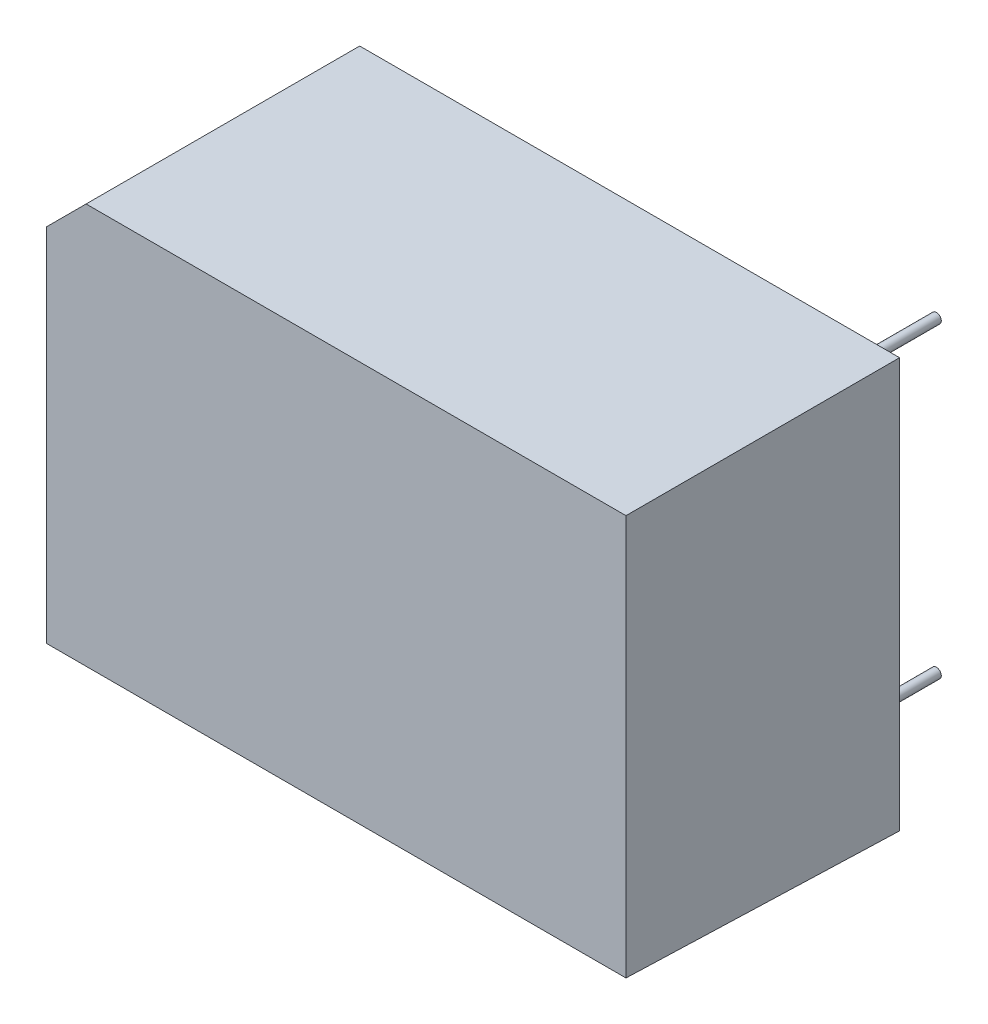
from build123d import *

# Parameters (mm, degrees)
SKETCH2_W           = 45.974
SKETCH2_H           = 32.004
BOSS_EXTRUDE1_DEPTH = 21
BOSS_EXTRUDE1_TAPER = 1
CUT_EXTRUDE1_DEPTH  = 36.006658981
SKETCH3_R           = 0.381
BOSS_EXTRUDE2_DEPTH = 8.128


with BuildPart() as part:
    # Sketch2 → Boss-Extrude1 (new body)
    with BuildSketch(Plane.XY):
        Rectangle(SKETCH2_W, SKETCH2_H)
    extrude(amount=BOSS_EXTRUDE1_DEPTH, taper=BOSS_EXTRUDE1_TAPER)

    # Sketch4 → Cut-Extrude1 (cut, through all)
    with BuildSketch(Plane.XY.offset(21)):
        Polygon((-19.177, 16.002), (-22.987, 16.002), (-22.987, 12.192), align=None)
    extrude(amount=-CUT_EXTRUDE1_DEPTH, mode=Mode.SUBTRACT)

    # Sketch3 → Boss-Extrude2 (add)
    with BuildSketch(Plane(origin=(0, 0, 0), x_dir=(-1, 0, 0), z_dir=(0, 0, -1))):
        with Locations(Location((-17.737, 11.998, 0), (0, 0, 180))):
            Circle(SKETCH3_R)
        with Locations(Location((17.763, 3.998, 0), (0, 0, 180))):
            Circle(SKETCH3_R)
        with Locations(Location((17.763, -12.002, 0), (0, 0, 180))):
            Circle(SKETCH3_R)
        with Locations(Location((-17.737, -12.002, 0), (0, 0, 180))):
            Circle(SKETCH3_R)
    extrude(amount=BOSS_EXTRUDE2_DEPTH)


solid = part.part
